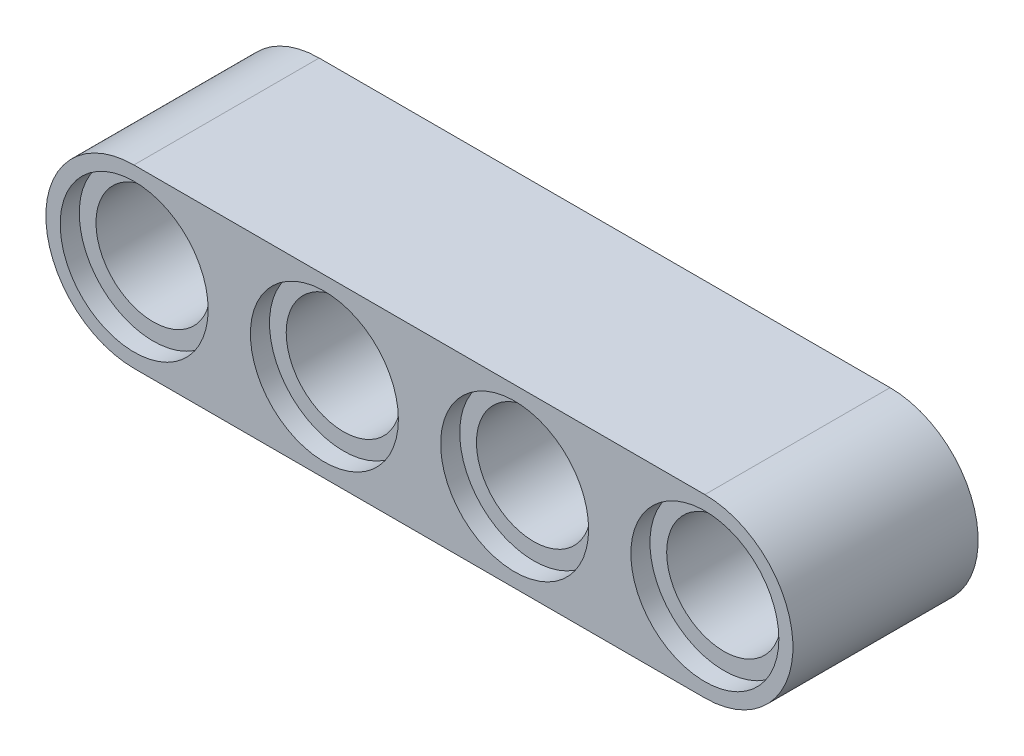
from build123d import *

# Parameters (mm, degrees)
BOSS_EXTRUDE1_DEPTH = 7.76
SKETCH2_R           = 3.1
CUT_EXTRUDE1_DEPTH  = 0.8
SKETCH3_R           = 2.4
CUT_EXTRUDE2_DEPTH  = 93.711483407
CUT_EXTRUDE3_START  = -0.8
SKETCH4_R           = 3.1
CUT_EXTRUDE3_DEPTH  = 0.8


with BuildPart() as part:
    # Sketch1 → Boss-Extrude1 (new body)
    with BuildSketch(Plane.XY):
        with BuildLine():
            Line((-88.686195286, 3.69), (-64.766195286, 3.69))
            ThreePointArc((-64.766195286, 3.69), (-61.076195286, 0), (-64.766195286, -3.69))
            Line((-64.766195286, -3.69), (-88.686195286, -3.69))
            ThreePointArc((-88.686195286, -3.69), (-92.376195286, 0), (-88.686195286, 3.69))
        make_face()
    extrude(amount=BOSS_EXTRUDE1_DEPTH)

    # Sketch2 → Cut-Extrude1 (cut)
    with BuildSketch(Plane(origin=(0, 0, 0), x_dir=(-1, 0, 0), z_dir=(0, 0, -1))):
        with Locations((64.766195286, 0)):
            Circle(SKETCH2_R)
        with Locations((72.736195286, 0)):
            Circle(SKETCH2_R)
        with Locations((80.706195286, 0)):
            Circle(SKETCH2_R)
        with Locations((88.676195286, 0)):
            Circle(SKETCH2_R)
    extrude(amount=-CUT_EXTRUDE1_DEPTH, mode=Mode.SUBTRACT)

    # Sketch3 → Cut-Extrude2 (cut, through all)
    with BuildSketch(Plane(origin=(0, 0, 0.8), x_dir=(-1, 0, 0), z_dir=(0, 0, -1))):
        with Locations((64.766195286, 0)):
            Circle(SKETCH3_R)
        with Locations((72.736195286, 0)):
            Circle(SKETCH3_R)
        with Locations((80.706195286, 0)):
            Circle(SKETCH3_R)
        with Locations((88.676195286, 0)):
            Circle(SKETCH3_R)
    extrude(amount=-CUT_EXTRUDE2_DEPTH, mode=Mode.SUBTRACT)

    # Sketch4 → Cut-Extrude3 (cut)
    with BuildSketch(Plane.XY.offset(7.76).offset(CUT_EXTRUDE3_START)):
        with Locations(Location((-88.676195286, 0, 0), (0, 0, 180))):
            Circle(SKETCH4_R)
        with Locations(Location((-80.706195286, 0, 0), (0, 0, 180))):
            Circle(SKETCH4_R)
        with Locations(Location((-72.736195286, 0, 0), (0, 0, 180))):
            Circle(SKETCH4_R)
        with Locations(Location((-64.766195286, 0, 0), (0, 0, 180))):
            Circle(SKETCH4_R)
    extrude(amount=CUT_EXTRUDE3_DEPTH, mode=Mode.SUBTRACT)


solid = part.part
